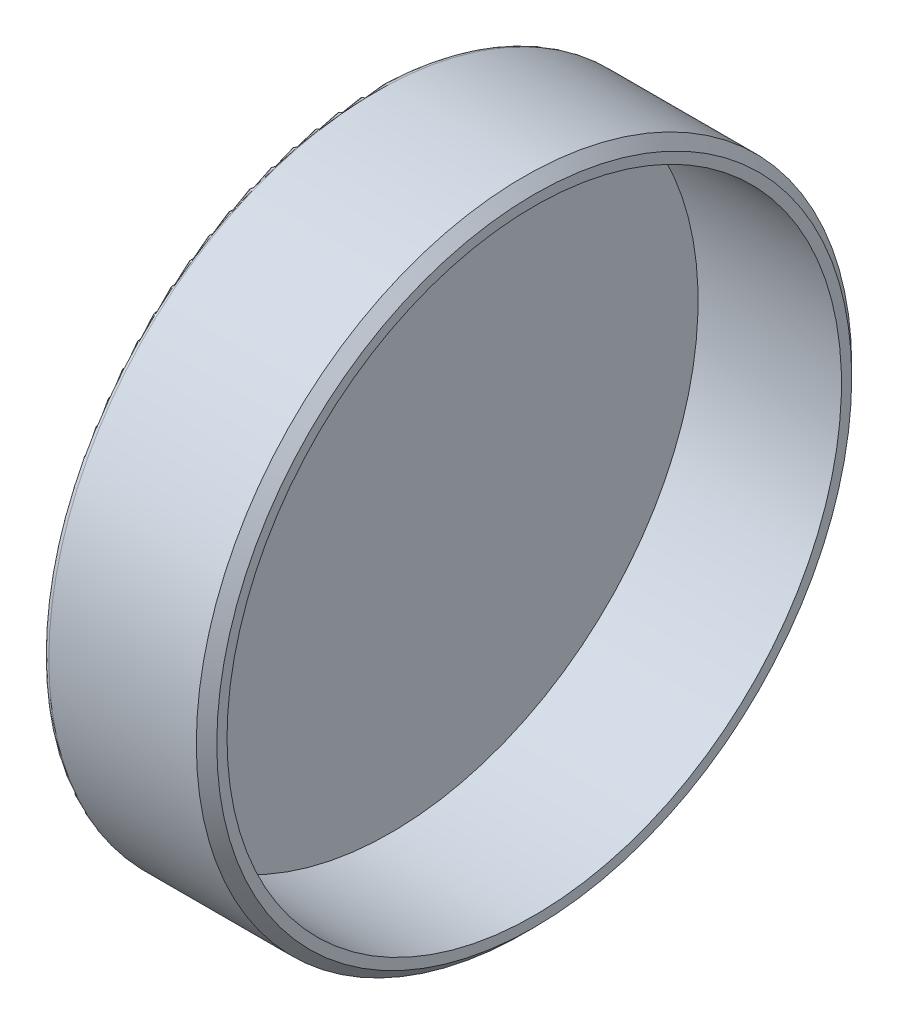
from build123d import *

# Parameters (mm, degrees)
CHANFREIN1_SIZE = 0.5
CONG_1_R        = 0.3


with BuildPart() as part:
    # Esquisse1 → Révol.-Mince2 (revolve)
    with BuildSketch(Plane.XY, mode=Mode.PRIVATE) as r_vol_mince2_sk:
        Polygon((0, 0), (0, 16), (8, 16), (8, 15), (1, 15), (1, 0), align=None)
    revolve(r_vol_mince2_sk.sketch.rotate(Axis((-7.892655367, 0, 0), (1, 0, 0)), 90), axis=Axis((-7.892655367, 0, 0), (1, 0, 0)))

    # Chanfrein1
    chanfrein1_edges = [part.edges().sort_by_distance(p)[0] for p in [
        (8, 0, -16),
    ]]
    chamfer(chanfrein1_edges, length=CHANFREIN1_SIZE)

    # Congé1
    cong_1_edges = [part.edges().sort_by_distance(p)[0] for p in [
        (0, 0, -16),
    ]]
    fillet(cong_1_edges, radius=CONG_1_R)


solid = part.part
